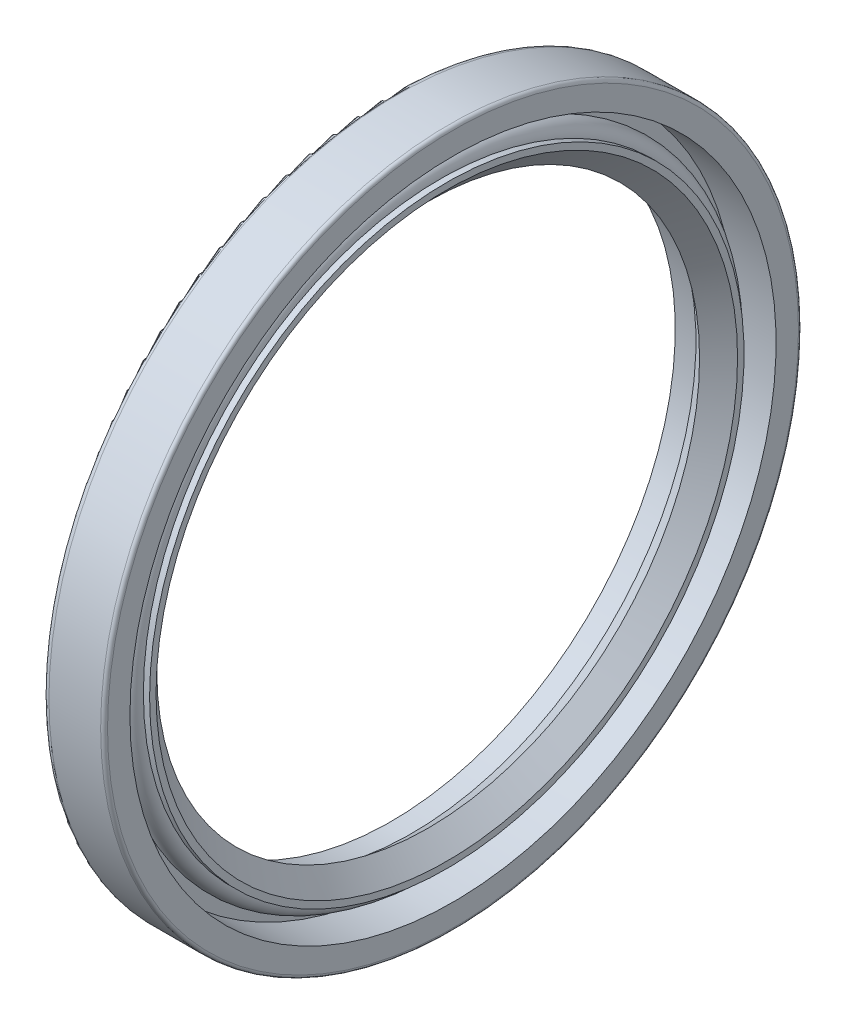
from build123d import *


with BuildPart() as part:
    # Schizzo1 → Rivoluzione1 (revolve)
    with BuildSketch(Plane.XY, mode=Mode.PRIVATE) as rivoluzione1_sk:
        with BuildLine():
            Line((0, 66.166666667), (0, 55))
            Line((0, 55), (4, 55))
            Line((4, 55), (7.2, 52.5))
            Line((7.2, 52.5), (10.8, 56.25))
            Line((10.8, 56.25), (10.8, 57.5))
            Line((10.8, 57.5), (9.6, 57.5))
            ThreePointArc((9.6, 57.5), (7.2, 59.9), (4.8, 57.5))
            Line((4.8, 57.5), (4, 57.5))
            Line((4, 57.5), (4, 62.5))
            Line((4, 62.5), (12, 62.5))
            Line((12, 62.5), (12, 66.833333333))
            ThreePointArc((12, 66.833333333), (11.804737854, 67.304737854), (11.333333333, 67.5))
            Line((11.333333333, 67.5), (1.333333333, 67.5))
            ThreePointArc((1.333333333, 67.5), (0.390524292, 67.109475708), (0, 66.166666667))
        make_face()
    revolve(rivoluzione1_sk.sketch.rotate(Axis((11.333333333, 0, 0), (-1, 0, 0)), 270), axis=Axis((11.333333333, 0, 0), (-1, 0, 0)))


solid = part.part
